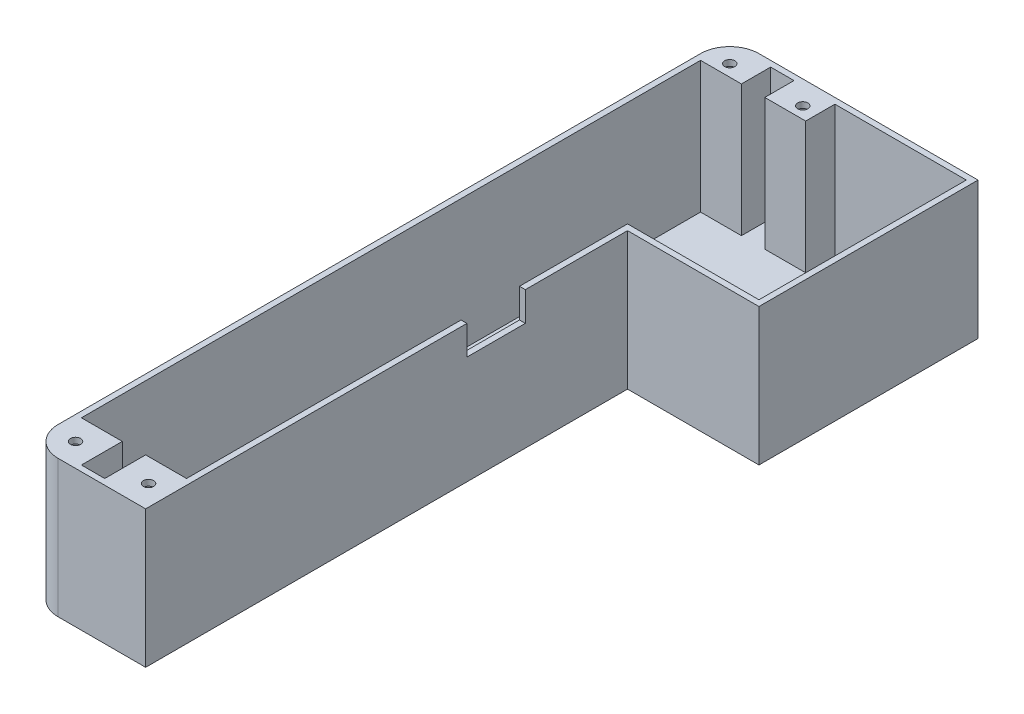
from build123d import *

# Parameters (mm, degrees)
SKETCH1_W           = 40
SKETCH1_H           = 240
BOSS_EXTRUDE2_DEPTH = 2
SKETCH2_W           = 40
SKETCH2_H           = 240
SKETCH2_W_2         = 36
SKETCH2_H_2         = 236
BOSS_EXTRUDE4_DEPTH = 45
SKETCH3_W           = 14
SKETCH3_H           = 14
BOSS_EXTRUDE5_DEPTH = 45
SKETCH4_R           = 1.75
CUT_EXTRUDE1_DEPTH  = 90
SKETCH5_R           = 3.5
CUT_EXTRUDE2_DEPTH  = 45
SKETCH6_W           = 20
SKETCH6_H           = 10
CUT_EXTRUDE3_DEPTH  = 10
FILLET3_R           = 10
FILLET4_R           = 10
SKETCH7_W           = 75
SKETCH7_H           = 47
BOSS_EXTRUDE6_DEPTH = 45
SKETCH8_W           = 45
SKETCH8_H           = 71
CUT_EXTRUDE4_DEPTH  = 45
SKETCH9_W           = 36
SKETCH9_H           = 4
CUT_EXTRUDE5_DEPTH  = 45


with BuildPart() as part:
    # Sketch1 → Boss-Extrude2 (new body)
    with BuildSketch(Plane(origin=(0, 0, 0), x_dir=(1, 0, 0), z_dir=(0, 1, 0))):
        Rectangle(SKETCH1_W, SKETCH1_H)
    extrude(amount=BOSS_EXTRUDE2_DEPTH)

    # Sketch2 → Boss-Extrude4 (add)
    with BuildSketch(Plane(origin=(0, 2, 0), x_dir=(1, 0, 0), z_dir=(0, 1, 0))):
        Rectangle(SKETCH2_W, SKETCH2_H)
        Rectangle(SKETCH2_W_2, SKETCH2_H_2, mode=Mode.SUBTRACT)
    extrude(amount=BOSS_EXTRUDE4_DEPTH)

    # Sketch3 → Boss-Extrude5 (add)
    with BuildSketch(Plane(origin=(0, 2, 0), x_dir=(1, 0, 0), z_dir=(0, 1, 0))):
        with Locations((-11, 111)):
            Rectangle(SKETCH3_W, SKETCH3_H)
        with Locations((11, 111)):
            Rectangle(SKETCH3_W, SKETCH3_H)
        with Locations((-11, -111)):
            Rectangle(SKETCH3_W, SKETCH3_H)
        with Locations((11, -111)):
            Rectangle(SKETCH3_W, SKETCH3_H)
    extrude(amount=BOSS_EXTRUDE5_DEPTH)

    # Sketch4 → Cut-Extrude1 (cut)
    with BuildSketch(Plane(origin=(0, 0, 0), x_dir=(-1, 0, 0), z_dir=(0, -1, 0))):
        with Locations(Location((12, -112, 0), (0, 0, 90))):
            Circle(SKETCH4_R)
        with Locations(Location((-13, -112, 0), (0, 0, 90))):
            Circle(SKETCH4_R)
        with Locations(Location((12, 112, 0), (0, 0, 90))):
            Circle(SKETCH4_R)
        with Locations(Location((-13, 112, 0), (0, 0, 90))):
            Circle(SKETCH4_R)
    extrude(amount=-CUT_EXTRUDE1_DEPTH, mode=Mode.SUBTRACT)

    # Sketch5 → Cut-Extrude2 (cut)
    with BuildSketch(Plane(origin=(0, 0, 0), x_dir=(-1, 0, 0), z_dir=(0, -1, 0))):
        with Locations(Location((12, -112, 0), (0, 0, 90))):
            Circle(SKETCH5_R)
        with Locations(Location((-13, -112, 0), (0, 0, 90))):
            Circle(SKETCH5_R)
        with Locations(Location((12, 112, 0), (0, 0, 90))):
            Circle(SKETCH5_R)
        with Locations(Location((-13, 112, 0), (0, 0, 90))):
            Circle(SKETCH5_R)
    extrude(amount=-CUT_EXTRUDE2_DEPTH, mode=Mode.SUBTRACT)

    # Sketch6 → Cut-Extrude3 (cut)
    with BuildSketch(Plane(origin=(20, 0, 0), x_dir=(0, 0, -1), z_dir=(1, 0, 0))):
        with Locations((0, 42)):
            Rectangle(SKETCH6_W, SKETCH6_H)
    extrude(amount=-CUT_EXTRUDE3_DEPTH, mode=Mode.SUBTRACT)

    # Fillet3
    fillet3_edges = [part.edges().sort_by_distance(p)[0] for p in [
        (-20, 23.5, -120),
    ]]
    fillet(fillet3_edges, radius=FILLET3_R)

    # Fillet4
    fillet4_edges = [part.edges().sort_by_distance(p)[0] for p in [
        (-20, 23.5, 120),
    ]]
    fillet(fillet4_edges, radius=FILLET4_R)

    # Sketch7 → Boss-Extrude6 (add)
    with BuildSketch(Plane(origin=(20, 0, 0), x_dir=(0, 0, -1), z_dir=(1, 0, 0))):
        with Locations((82.5, 23.5)):
            Rectangle(SKETCH7_W, SKETCH7_H)
    extrude(amount=BOSS_EXTRUDE6_DEPTH)

    # Sketch8 → Cut-Extrude4 (cut)
    with BuildSketch(Plane(origin=(0, 47, 0), x_dir=(1, 0, 0), z_dir=(0, 1, 0))):
        with Locations((40.5, 82.5)):
            Rectangle(SKETCH8_W, SKETCH8_H)
    extrude(amount=-CUT_EXTRUDE4_DEPTH, mode=Mode.SUBTRACT)

    # Sketch9 → Cut-Extrude5 (cut)
    with BuildSketch(Plane(origin=(0, 47, 0), x_dir=(1, 0, 0), z_dir=(0, 1, 0))):
        with Locations((0, 106)):
            Rectangle(SKETCH9_W, SKETCH9_H)
    extrude(amount=-CUT_EXTRUDE5_DEPTH, mode=Mode.SUBTRACT)


solid = part.part
